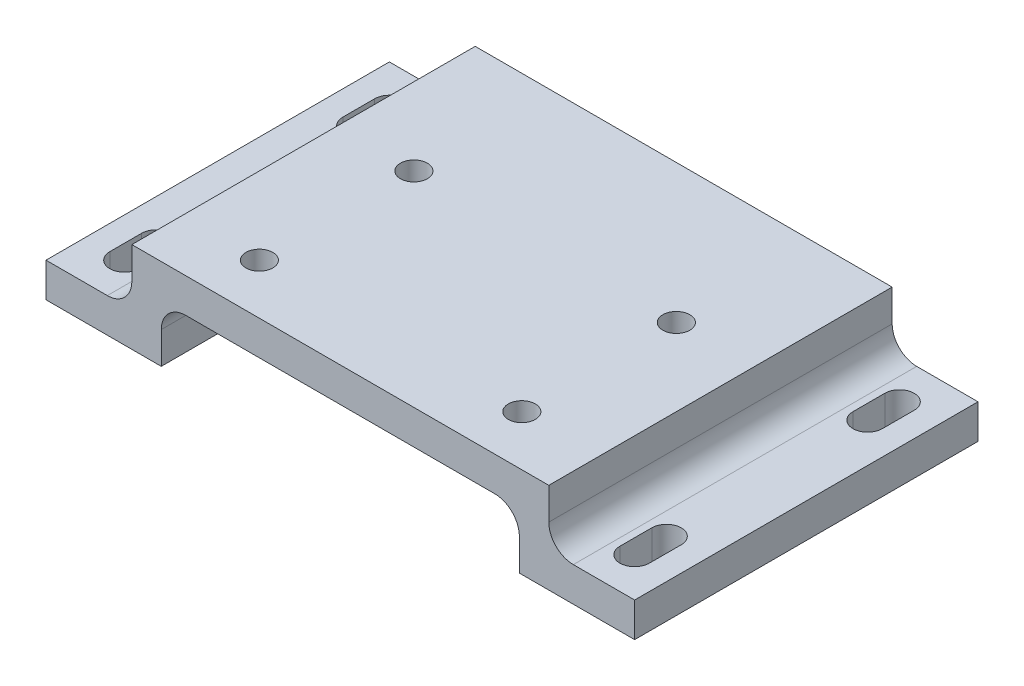
from build123d import *

# Parameters (mm, degrees)
BOSS_EXTRUDE1_DEPTH      = 35
BOSS_EXTRUDE1_DEPTH_BACK = 35
FILLET1_R                = 5
CUT_EXTRUDE1_DEPTH       = 71.407741052
CUT_EXTRUDE1_DEPTH_BACK  = 71.407741052
SKETCH2_R                = 2.75


with BuildPart() as part:
    # Sketch1 → Boss-Extrude1 (new, two sides: drawn at the far end of the back side and taken through both)
    with BuildSketch(Plane.XY.offset(-BOSS_EXTRUDE1_DEPTH_BACK)):
        Polygon((-60, -11.5), (-36.5, -11.5), (-36.5, 0), (36.5, 0), (36.5, -11.5), (60, -11.5), (60, -4.5), (42.5, -4.5), (42.5, 7), (-42.5, 7), (-42.5, -4.5), (-60, -4.5), align=None)
    extrude(amount=BOSS_EXTRUDE1_DEPTH + BOSS_EXTRUDE1_DEPTH_BACK)

    # Fillet1
    fillet1_edges = [part.edges().sort_by_distance(p)[0] for p in [
        (36.5, 0, 0),
        (-36.5, 0, 0),
        (-42.5, -4.5, 0),
        (42.5, -4.5, 0),
    ]]
    fillet(fillet1_edges, radius=FILLET1_R)

    # Sketch2 → Cut-Extrude1 (cut, two sides: drawn at the far end of the back side and taken through both)
    with BuildSketch(Plane(origin=(0, 0, 0), x_dir=(1, 0, 0), z_dir=(0, 1, 0)).offset(-CUT_EXTRUDE1_DEPTH_BACK)):
        with BuildLine():
            Line((-49, -27), (-49, -20.5))
            ThreePointArc((-49, -20.5), (-52, -17.5), (-55, -20.5))
            Line((-55, -20.5), (-55, -27))
            ThreePointArc((-55, -27), (-52, -30), (-49, -27))
        make_face()
        with BuildLine():
            ThreePointArc((55, -20.5), (52, -17.5), (49, -20.5))
            Line((49, -20.5), (49, -27))
            ThreePointArc((49, -27), (52, -30), (55, -27))
            Line((55, -27), (55, -20.5))
        make_face()
        with BuildLine():
            ThreePointArc((55, 27), (52, 30), (49, 27))
            Line((49, 27), (49, 20.5))
            ThreePointArc((49, 20.5), (52, 17.5), (55, 20.5))
            Line((55, 20.5), (55, 27))
        make_face()
        with BuildLine():
            Line((-49, 20.5), (-49, 27))
            ThreePointArc((-49, 27), (-52, 30), (-55, 27))
            Line((-55, 27), (-55, 20.5))
            ThreePointArc((-55, 20.5), (-52, 17.5), (-49, 20.5))
        make_face()
        with Locations((-26.75, 6.75)):
            Circle(SKETCH2_R)
        with Locations((-26.75, -24.75)):
            Circle(SKETCH2_R)
        with Locations((26.75, 6.75)):
            Circle(SKETCH2_R)
        with Locations((26.75, -24.75)):
            Circle(SKETCH2_R)
    extrude(amount=CUT_EXTRUDE1_DEPTH + CUT_EXTRUDE1_DEPTH_BACK, mode=Mode.SUBTRACT)


solid = part.part
